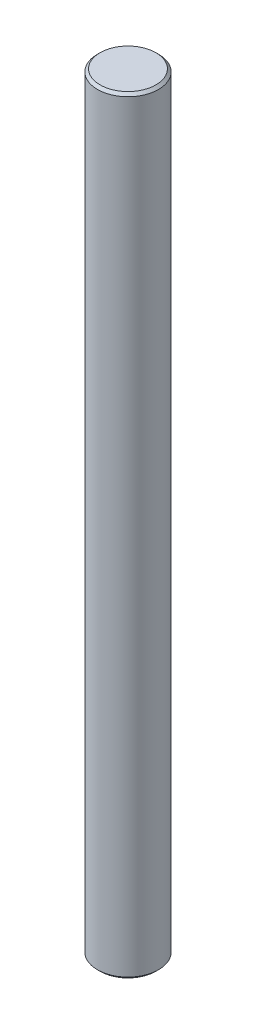
from build123d import *

# Parameters (mm, degrees)
SKETCH2_W          = 17.5
SKETCH2_H          = 440
CHAMFER1_SIZE      = 1.5
SKETCH3_R          = 0.5
CUT_EXTRUDE1_DEPTH = 3


with BuildPart() as part:
    # Sketch2 → Revolve1 (revolve)
    with BuildSketch(Plane.XY, mode=Mode.PRIVATE) as revolve1_sk:
        with Locations((8.75, 220)):
            Rectangle(SKETCH2_W, SKETCH2_H)
    revolve(revolve1_sk.sketch.rotate(Axis((0, 440, 0), (0, -1, 0)), 180), axis=Axis((0, 440, 0), (0, -1, 0)))

    # Chamfer1
    chamfer1_edges = [part.edges().sort_by_distance(p)[0] for p in [
        (17.5, 0, 0),
        (17.5, 440, 0),
    ]]
    chamfer(chamfer1_edges, length=CHAMFER1_SIZE)

    # Sketch3 → Cut-Extrude1 (cut)
    with BuildSketch(Plane.XZ):
        Circle(SKETCH3_R)
    extrude(amount=-CUT_EXTRUDE1_DEPTH, mode=Mode.SUBTRACT)


solid = part.part
